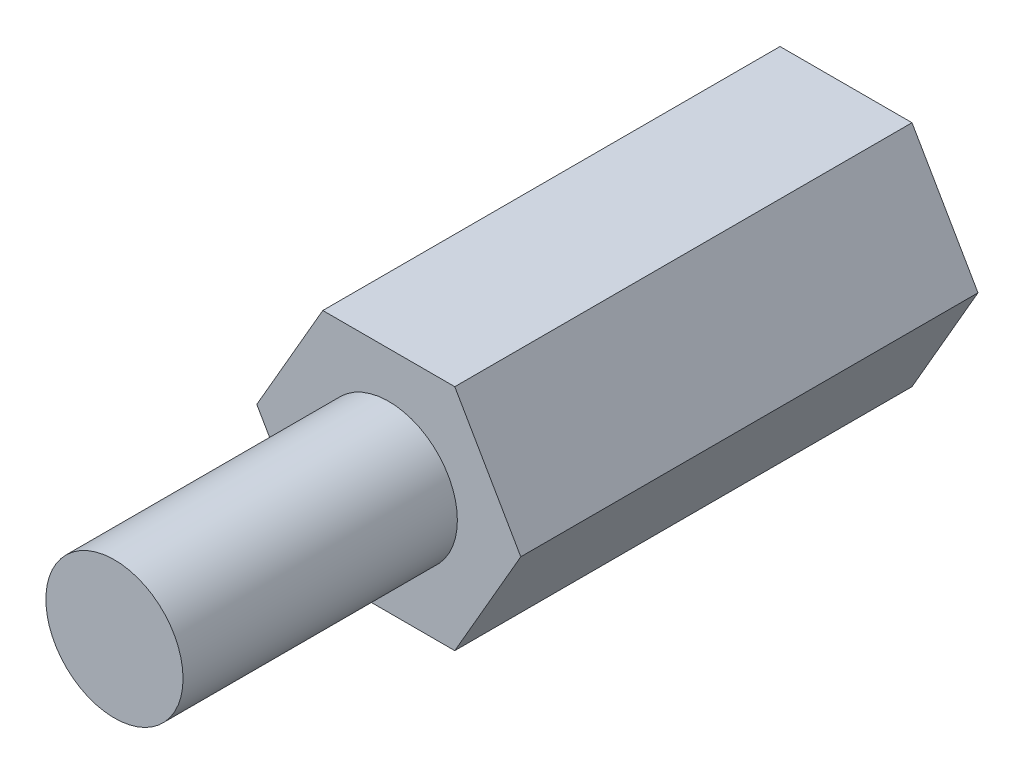
from build123d import *

# Parameters (mm, degrees)
EXTRUDE_1_DEPTH = 10
SKETCH_2_R      = 1.5
EXTRUDE_2_DEPTH = 6
M3X0_5_1_D      = 2.5
M3X0_5_1_DEPTH  = 11
M3X0_5_1_TIP    = 0.751075774


with BuildPart() as part:
    # 草图1 → 拉伸1 (new body)
    with BuildSketch(Plane.XY):
        Polygon((1.443375673, -2.5), (2.886751346, 0), (1.443375673, 2.5), (-1.443375673, 2.5), (-2.886751346, 0), (-1.443375673, -2.5), align=None)
    extrude(amount=EXTRUDE_1_DEPTH)

    # 草图2 → 拉伸2 (add)
    with BuildSketch(Plane.XY.offset(10)):
        Circle(SKETCH_2_R)
    extrude(amount=EXTRUDE_2_DEPTH)

    # M3x0.5 螺纹孔1
    with Locations(Plane(origin=(0, 0, 0), x_dir=(-1, 0, 0), z_dir=(0, 0, -1))):
        with Locations((0, 0)):
            Hole(M3X0_5_1_D / 2, depth=M3X0_5_1_DEPTH)
            with Locations((0, 0, -(M3X0_5_1_DEPTH + M3X0_5_1_TIP / 2))):  # 118° drill point
                Cone(0, M3X0_5_1_D / 2, M3X0_5_1_TIP, mode=Mode.SUBTRACT)


solid = part.part
